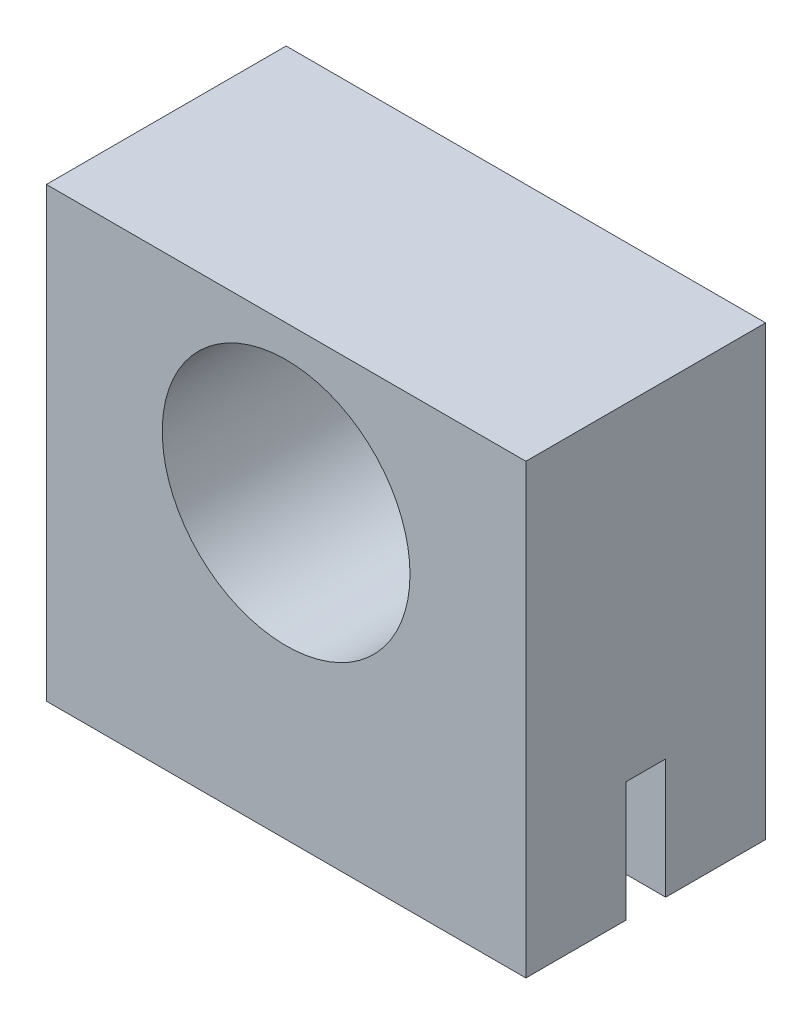
from build123d import *

# Parameters (mm, degrees)
EXTRUDE_1_DEPTH          = 60
CUT_EXTRUDE_1_DEPTH      = 40
CUT_EXTRUDE_1_DEPTH_BACK = 29
SKETCH_4_R               = 15.5
SKETCH_5_W               = 5
SKETCH_5_H               = 30
CUT_EXTRUDE_2_DEPTH      = 83.900874001
CUT_EXTRUDE_START        = 25
SKETCH_6_W               = 60
SKETCH_6_H               = 56
CUT_EXTRUDE_3_DEPTH      = 10
CUT_EXTRUDE_START_2      = -15
SKETCH_7_W               = 60
SKETCH_7_H               = 56
CUT_EXTRUDE_4_DEPTH      = 10


with BuildPart() as part:
    # 스케치3 → 보스-돌출1 (new body)
    with BuildSketch(Plane(origin=(0, 0, 0), x_dir=(0, 0, -1), z_dir=(1, 0, 0))):
        Polygon((-25, -51.454396413), (25, -51.454396413), (15, 4.545603587), (-15, 4.545603587), align=None)
    extrude(amount=EXTRUDE_1_DEPTH)

    # 스케치4 → 컷-돌출1 (cut, two sides: drawn at the far end of the back side and taken through both)
    with BuildSketch(Plane.XY.offset(-CUT_EXTRUDE_1_DEPTH_BACK)):
        with Locations(Location((30, -14.954396413, 0), (0, 0, 90))):
            Circle(SKETCH_4_R)
    extrude(amount=CUT_EXTRUDE_1_DEPTH + CUT_EXTRUDE_1_DEPTH_BACK, mode=Mode.SUBTRACT)

    # 스케치5 → 컷-돌출2 (cut, through all)
    with BuildSketch(Plane(origin=(0, 0, 0), x_dir=(0, 0, -1), z_dir=(1, 0, 0))):
        with Locations((0, -51.454396413)):
            Rectangle(SKETCH_5_W, SKETCH_5_H)
    extrude(amount=CUT_EXTRUDE_2_DEPTH, mode=Mode.SUBTRACT)

    # 스케치6 → 컷-돌출3 (cut)
    with BuildSketch(Plane.XY.offset(CUT_EXTRUDE_START)):
        with Locations((30, -23.454396413)):
            Rectangle(SKETCH_6_W, SKETCH_6_H)
    extrude(amount=-CUT_EXTRUDE_3_DEPTH, mode=Mode.SUBTRACT)

    # 스케치7 → 컷-돌출4 (cut)
    with BuildSketch(Plane.XY.offset(CUT_EXTRUDE_START_2)):
        with Locations((30, -23.454396413)):
            Rectangle(SKETCH_7_W, SKETCH_7_H)
    extrude(amount=-CUT_EXTRUDE_4_DEPTH, mode=Mode.SUBTRACT)


solid = part.part
